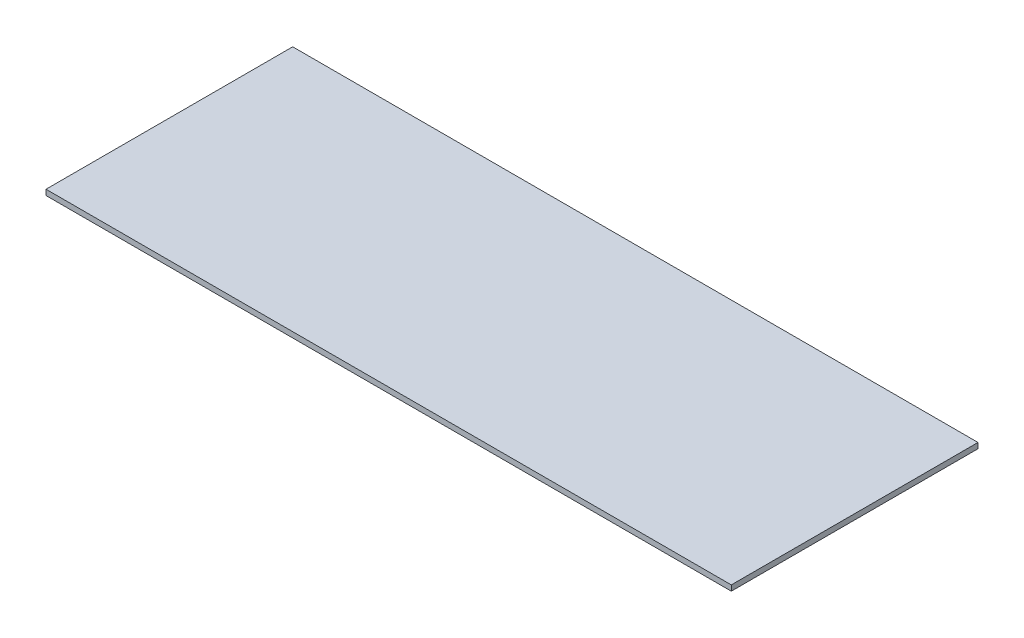
from build123d import *

# Parameters (mm, degrees)
SKETCH1_W           = 1250
SKETCH1_H           = 450
BOSS_EXTRUDE1_DEPTH = 10


with BuildPart() as part:
    # Sketch1 → Boss-Extrude1 (new body)
    with BuildSketch(Plane(origin=(0, 0, 0), x_dir=(1, 0, 0), z_dir=(0, 1, 0))):
        Rectangle(SKETCH1_W, SKETCH1_H)
    extrude(amount=BOSS_EXTRUDE1_DEPTH)


solid = part.part
